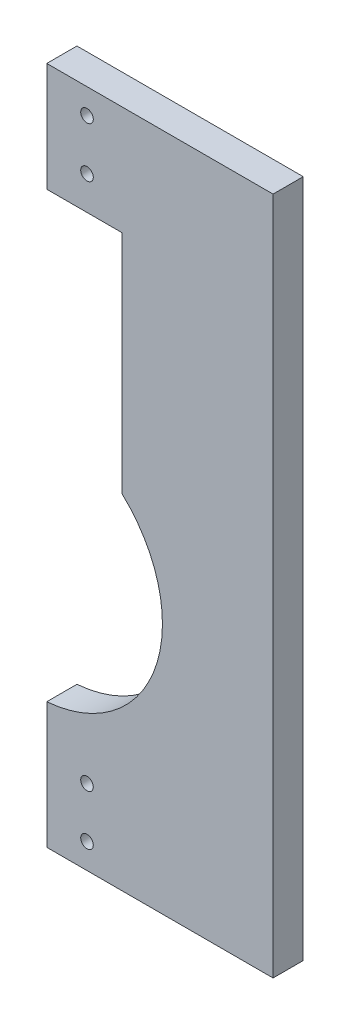
from build123d import *

# Parameters (mm, degrees)
ESQUISSE1_W             = 45
ESQUISSE1_H             = 135
ESQUISSE1_R             = 1.25
BOSS_EXTRU_1_DEPTH      = 6
ENL_V_MAT_EXTRU_1_DEPTH = 143.428929646


with BuildPart() as part:
    # Esquisse1 → Boss.-Extru.1 (new body)
    with BuildSketch(Plane.XY):
        with Locations((22.5, 67.5)):
            Rectangle(ESQUISSE1_W, ESQUISSE1_H)
        with Locations((8, 5)):
            Circle(ESQUISSE1_R, mode=Mode.SUBTRACT)
        with Locations((8, 15)):
            Circle(ESQUISSE1_R, mode=Mode.SUBTRACT)
        with Locations(Location((8, 120, 0), (0, 0, 180))):
            Circle(ESQUISSE1_R, mode=Mode.SUBTRACT)
        with Locations(Location((8, 130, 0), (0, 0, 180))):
            Circle(ESQUISSE1_R, mode=Mode.SUBTRACT)
    extrude(amount=BOSS_EXTRU_1_DEPTH)

    # Esquisse2 → Enlèv. mat.-Extru.1 (cut, through all)
    with BuildSketch(Plane(origin=(0, 0, 0), x_dir=(-1, 0, 0), z_dir=(0, 0, -1))):
        with BuildLine():
            Line((0, 25.080128411), (0, 113.33030278))
            Line((0, 113.33030278), (-15, 113.33030278))
            Line((-15, 113.33030278), (-15, 68.33030278))
            ThreePointArc((-15, 68.33030278), (-21.619788224, 41.80819896), (0, 25.080128411))
        make_face()
    extrude(amount=-ENL_V_MAT_EXTRU_1_DEPTH, mode=Mode.SUBTRACT)


solid = part.part
